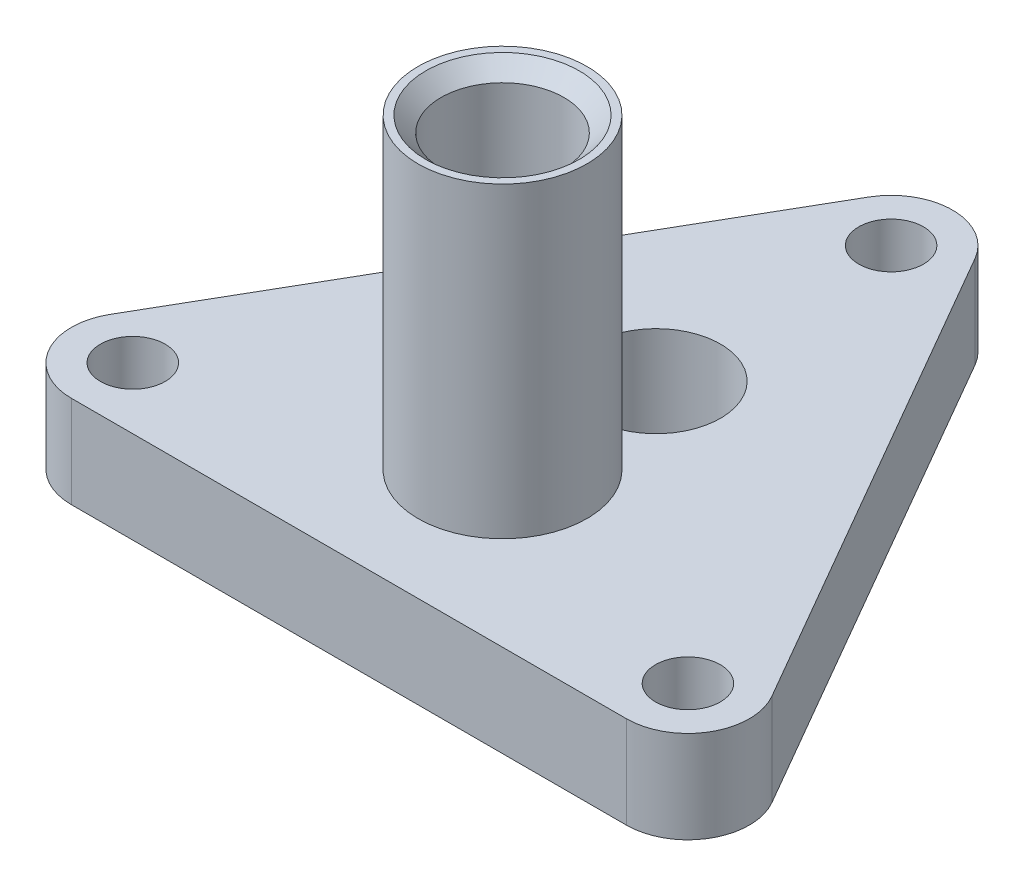
from build123d import *

# Parameters (mm, degrees)
SKETCH1_R           = 1.054
BOSS_EXTRUDE1_DEPTH = 3
SKETCH2_R           = 0.8
SKETCH2_R_2         = 2.0955
CUT_EXTRUDE1_DEPTH  = 23.736281859
SKETCH3_R           = 2.75
BOSS_EXTRUDE2_DEPTH = 10
CUT_EXTRUDE2_REACH  = 26.656
SKETCH4_R           = 2
CHAMFER1_SIZE       = 2
CHAMFER1_SIZE2      = 0.727940469
CHAMFER2_SIZE       = 0.5


with BuildPart() as part:
    # Sketch1 → Boss-Extrude1 (new body)
    with BuildSketch(Plane(origin=(0, 0, 0), x_dir=(1, 0, 0), z_dir=(0, 1, 0))):
        with BuildLine():
            Line((0, 0), (9.035898385, 0))
            ThreePointArc((9.035898385, 0), (10.767949192, 1), (10.767949192, 3))
            Line((10.767949192, 3), (1.732050808, 18.650635095))
            ThreePointArc((1.732050808, 18.650635095), (0, 19.650635095), (-1.732050808, 18.650635095))
            Line((-1.732050808, 18.650635095), (-10.767949192, 3))
            ThreePointArc((-10.767949192, 3), (-10.767949192, 1), (-9.035898385, 0))
            Line((-9.035898385, 0), (0, 0))
        make_face()
        with Locations(Location((0, 17.650635095, 0), (0, 0, 270))):
            Circle(SKETCH1_R, mode=Mode.SUBTRACT)
        with Locations(Location((-9.035898385, 2, 0), (0, 0, 270))):
            Circle(SKETCH1_R, mode=Mode.SUBTRACT)
        with Locations(Location((9.035898385, 2, 0), (0, 0, 270))):
            Circle(SKETCH1_R, mode=Mode.SUBTRACT)
    extrude(amount=BOSS_EXTRUDE1_DEPTH)

    # Sketch2 → Cut-Extrude1 (cut, through all)
    with BuildSketch(Plane(origin=(0, 3, 0), x_dir=(1, 0, 0), z_dir=(0, 1, 0))):
        with Locations(Location((0, 5, 0), (0, 0, 270))):
            Circle(SKETCH2_R)
        with Locations(Location((0, 10, 0), (0, 0, 270))):
            Circle(SKETCH2_R_2)
    extrude(amount=-CUT_EXTRUDE1_DEPTH, mode=Mode.SUBTRACT)

    # Sketch3 → Boss-Extrude2 (add)
    with BuildSketch(Plane(origin=(0, 3, 0), x_dir=(1, 0, 0), z_dir=(0, 1, 0))):
        with Locations(Location((0, 5, 0), (0, 0, 270))):
            Circle(SKETCH3_R)
    extrude(amount=BOSS_EXTRUDE2_DEPTH)

    # Sketch4 → Cut-Extrude2 (cut, up to next)
    with BuildSketch(Plane(origin=(0, 3, 0), x_dir=(1, 0, 0), z_dir=(0, 1, 0)), mode=Mode.PRIVATE) as cut_extrude2_sk1:
        with Locations(Location((0, 5, 0), (0, 0, 270))):
            Circle(SKETCH4_R)
    cut_extrude2_tool1 = extrude(cut_extrude2_sk1.sketch, amount=CUT_EXTRUDE2_REACH, mode=Mode.PRIVATE) & part.part
    add(cut_extrude2_tool1.solids().sort_by_distance((0, 3, -5))[0], mode=Mode.SUBTRACT)

    # Chamfer1
    chamfer1_edges = [part.edges().sort_by_distance(p)[0] for p in [
        (0, 3, -7),
    ]]
    chamfer1_side = [part.faces().sort_by_distance(p)[0] for p in [
        (0, 8, -7),
    ]]
    chamfer(chamfer1_edges, length=CHAMFER1_SIZE, length2=CHAMFER1_SIZE2, reference=chamfer1_side[0])

    # Chamfer2
    chamfer2_edges = [part.edges().sort_by_distance(p)[0] for p in [
        (0, 13, -7),
    ]]
    chamfer(chamfer2_edges, length=CHAMFER2_SIZE)


solid = part.part
